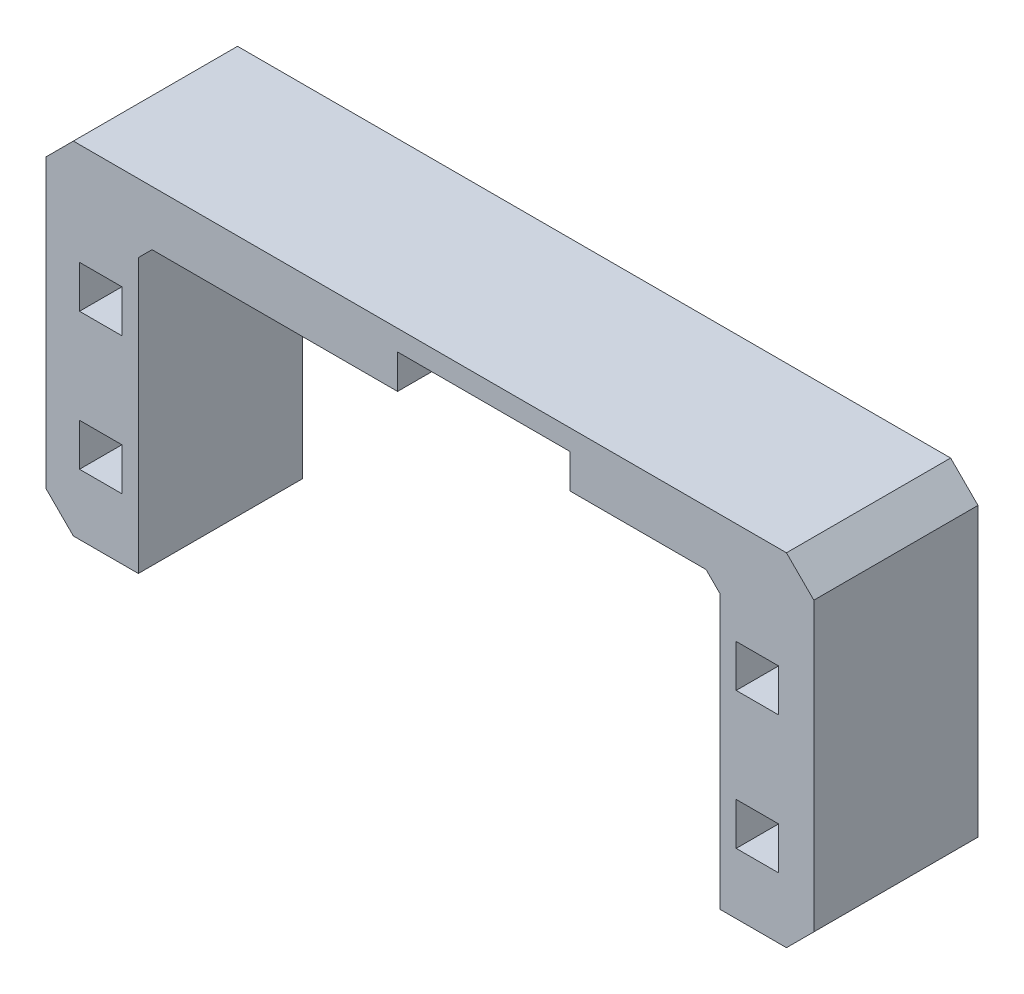
from build123d import *

# Parameters (mm, degrees)
ESBO_O2_W                = 2.5
ESBO_O2_H                = 2.5
RESSALTO_EXTRUS_O1_DEPTH = 12
ESBO_O5_W                = 0.7
ESBO_O5_H                = 2.5
RESSALTO_EXTRUS_O2_DEPTH = 12
ESBO_O7_W                = 3.1
ESBO_O7_H                = 3.1
CORTE_EXTRUS_O5_DEPTH    = 90.954849667


with BuildPart() as part:
    # Esboço2 → Ressalto-extrusão1 (new body)
    with BuildSketch(Plane.XY):
        Polygon((70.72996521, 18.87874794), (75.60496521, 18.87874794), (77.60496521, 20.87874794), (77.60496521, 41.878746033), (75.60496521, 43.878746033), (23.479967117, 43.878746033), (21.479967117, 41.878746033), (21.479967117, 20.87874794), (23.479967117, 18.87874794), (28.229967117, 18.87874794), (28.229967117, 38.878746033), (29.229967117, 39.878746033), (46.47996521, 39.878746033), (46.47996521, 42.378746033), (53.47996521, 42.378746033), (60.47996521, 42.378746033), (60.47996521, 39.878746033), (69.72996521, 39.878746033), (70.72996521, 38.878746033), align=None)
        with Locations((25.479967117, 34.878746033)):
            Rectangle(ESBO_O2_W, ESBO_O2_H, mode=Mode.SUBTRACT)
        with Locations((25.479967117, 24.87874794)):
            Rectangle(ESBO_O2_W, ESBO_O2_H, mode=Mode.SUBTRACT)
        with Locations((73.47996521, 34.878746033)):
            Rectangle(ESBO_O2_W, ESBO_O2_H, mode=Mode.SUBTRACT)
        with Locations((73.47996521, 24.87874794)):
            Rectangle(ESBO_O2_W, ESBO_O2_H, mode=Mode.SUBTRACT)
    extrude(amount=RESSALTO_EXTRUS_O1_DEPTH)

    # Esboço5 → Ressalto-extrusão2 (add, through all)
    with BuildSketch(Plane(origin=(0, 0, 0), x_dir=(-1, 0, 0), z_dir=(0, 0, -1))):
        with Locations((-60.12996521, 41.128746033)):
            Rectangle(ESBO_O5_W, ESBO_O5_H)
        with Locations((-46.82996521, 41.128746033)):
            Rectangle(ESBO_O5_W, ESBO_O5_H)
    extrude(amount=-RESSALTO_EXTRUS_O2_DEPTH)

    # Esboço7 → Corte-extrusão5 (cut, through all)
    with BuildSketch(Plane(origin=(0, 0, 0), x_dir=(-1, 0, 0), z_dir=(0, 0, -1))):
        with Locations((-73.47996521, 34.878746033)):
            Rectangle(ESBO_O7_W, ESBO_O7_H)
        with Locations((-73.47996521, 24.87874794)):
            Rectangle(ESBO_O7_W, ESBO_O7_H)
        with Locations((-25.479967117, 24.87874794)):
            Rectangle(ESBO_O7_W, ESBO_O7_H)
        with Locations((-25.479967117, 34.878746033)):
            Rectangle(ESBO_O7_W, ESBO_O7_H)
    extrude(amount=-CORTE_EXTRUS_O5_DEPTH, mode=Mode.SUBTRACT)


solid = part.part
